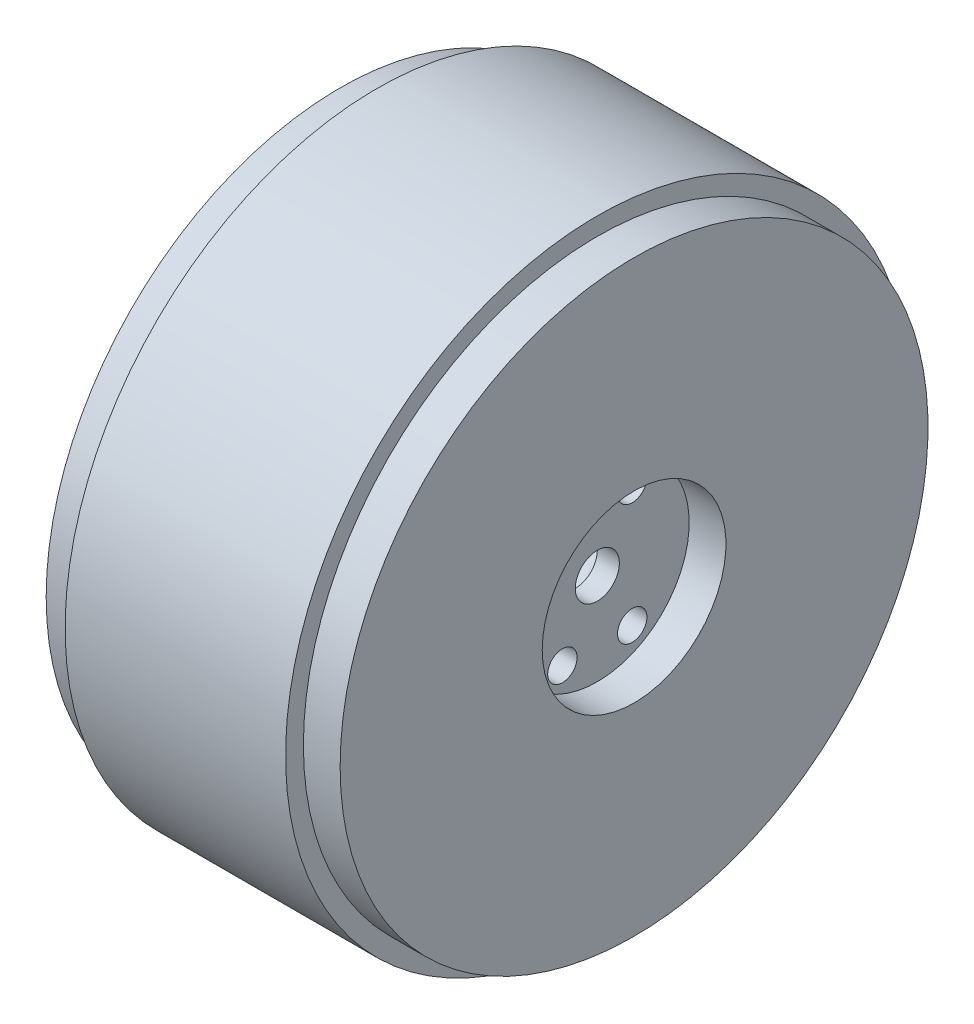
from build123d import *

# Parameters (mm, degrees)
ESQUISSE2_W             = 5
ESQUISSE2_H             = 12.5
ESQUISSE3_R             = 2
ENL_V_MAT_EXTRU_1_DEPTH = 67.520673478
ESQUISSE4_R             = 3
ENL_V_MAT_EXTRU_2_DEPTH = 67.520673478
ESQUISSE5_W             = 30
ESQUISSE5_H             = 3.421913798


with BuildPart() as part:
    # Esquisse1 → Révolution1 (revolve)
    with BuildSketch(Plane.XY, mode=Mode.PRIVATE) as r_volution1_sk:
        Polygon((0, 34), (0, 0), (8, 0), (8, 40), (3, 40), (3, 39), (-27, 39), (-27, 40), (-32, 40), (-32, 34), align=None)
    revolve(r_volution1_sk.sketch.rotate(Axis((-49.644499027, 0, 0), (1, 0, 0)), 90), axis=Axis((-49.644499027, 0, 0), (1, 0, 0)))

    # Esquisse2 → Enlèvement de matière-Révolution1 (revolve, cut)
    with BuildSketch(Plane.XY, mode=Mode.PRIVATE) as enl_vement_de_mati_re_r_volution1_sk:
        with Locations((5.5, 6.25)):
            Rectangle(ESQUISSE2_W, ESQUISSE2_H)
    revolve(enl_vement_de_mati_re_r_volution1_sk.sketch.rotate(Axis((0, 0, 0), (1, 0, 0)), 90), axis=Axis((0, 0, 0), (1, 0, 0)), mode=Mode.SUBTRACT)

    # Esquisse3 → Enlèv. mat.-Extru.1 (cut, through all)
    with BuildSketch(Plane(origin=(3, 0, 0), x_dir=(0, 0, -1), z_dir=(1, 0, 0))):
        with Locations((4.75, 8.227241336)):
            Circle(ESQUISSE3_R)
        with Locations((-4.75, 8.227241336)):
            Circle(ESQUISSE3_R)
        with Locations((4.75, -8.227241336)):
            Circle(ESQUISSE3_R)
        with Locations((-4.75, -8.227241336)):
            Circle(ESQUISSE3_R)
    extrude(amount=-ENL_V_MAT_EXTRU_1_DEPTH, mode=Mode.SUBTRACT)

    # Esquisse4 → Enlèv. mat.-Extru.2 (cut, through all)
    with BuildSketch(Plane(origin=(3, 0, 0), x_dir=(0, 0, -1), z_dir=(1, 0, 0))):
        Circle(ESQUISSE4_R)
    extrude(amount=-ENL_V_MAT_EXTRU_2_DEPTH, mode=Mode.SUBTRACT)

    # Esquisse5 → Révolution2 (revolve)
    with BuildSketch(Plane.XY, mode=Mode.PRIVATE) as r_volution2_sk:
        with Locations((-12, 40.710956899)):
            Rectangle(ESQUISSE5_W, ESQUISSE5_H)
    revolve(r_volution2_sk.sketch.rotate(Axis((0, 0, 0), (-1, 0, 0)), 90), axis=Axis((0, 0, 0), (-1, 0, 0)))


solid = part.part
